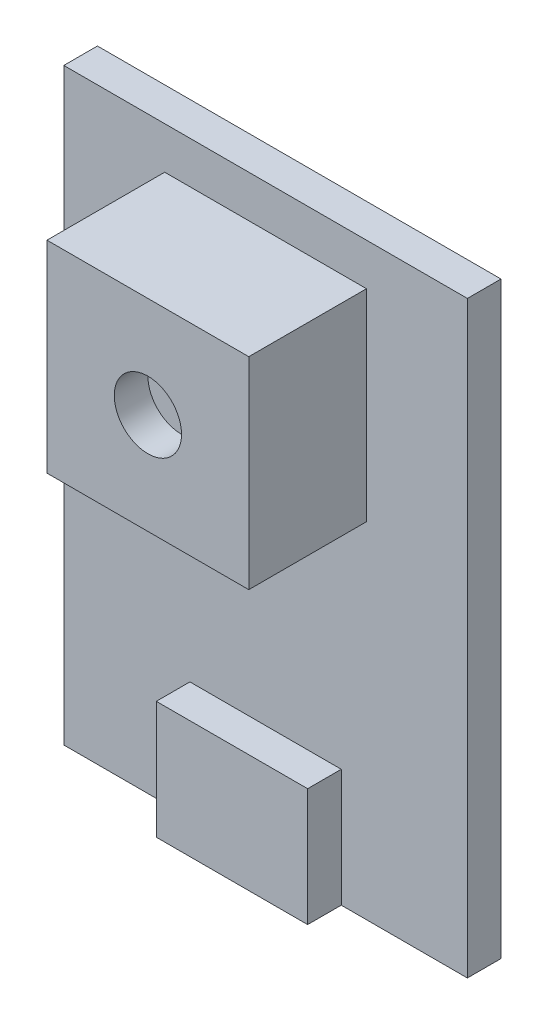
from build123d import *

# Parameters (mm, degrees)
SKETCH_1_W          = 12
SKETCH_1_H          = 12
EXTRUDE_1_DEPTH     = 7
SKETCH_2_W          = 24
SKETCH_2_H          = 35
EXTRUDE_2_DEPTH     = 2
SKETCH_3_W          = 9
SKETCH_3_H          = 7
EXTRUDE_3_DEPTH     = 2
SKETCH_4_R          = 2
CUT_EXTRUDE_1_DEPTH = 2


with BuildPart() as part:
    # 스케치1 → 보스-돌출1 (new body)
    with BuildSketch(Plane.XY):
        Rectangle(SKETCH_1_W, SKETCH_1_H)
    extrude(amount=EXTRUDE_1_DEPTH)

    # 스케치2 → 보스-돌출2 (add)
    with BuildSketch(Plane(origin=(0, 0, 0), x_dir=(-1, 0, 0), z_dir=(0, 0, -1))):
        with Locations((0, -9)):
            Rectangle(SKETCH_2_W, SKETCH_2_H)
    extrude(amount=EXTRUDE_2_DEPTH)

    # 스케치3 → 보스-돌출3 (add)
    with BuildSketch(Plane.XY):
        with Locations((0, -23)):
            Rectangle(SKETCH_3_W, SKETCH_3_H)
    extrude(amount=EXTRUDE_3_DEPTH)

    # 스케치4 → 컷-돌출1 (cut)
    with BuildSketch(Plane.XY.offset(7)):
        Circle(SKETCH_4_R)
    extrude(amount=-CUT_EXTRUDE_1_DEPTH, mode=Mode.SUBTRACT)


solid = part.part
